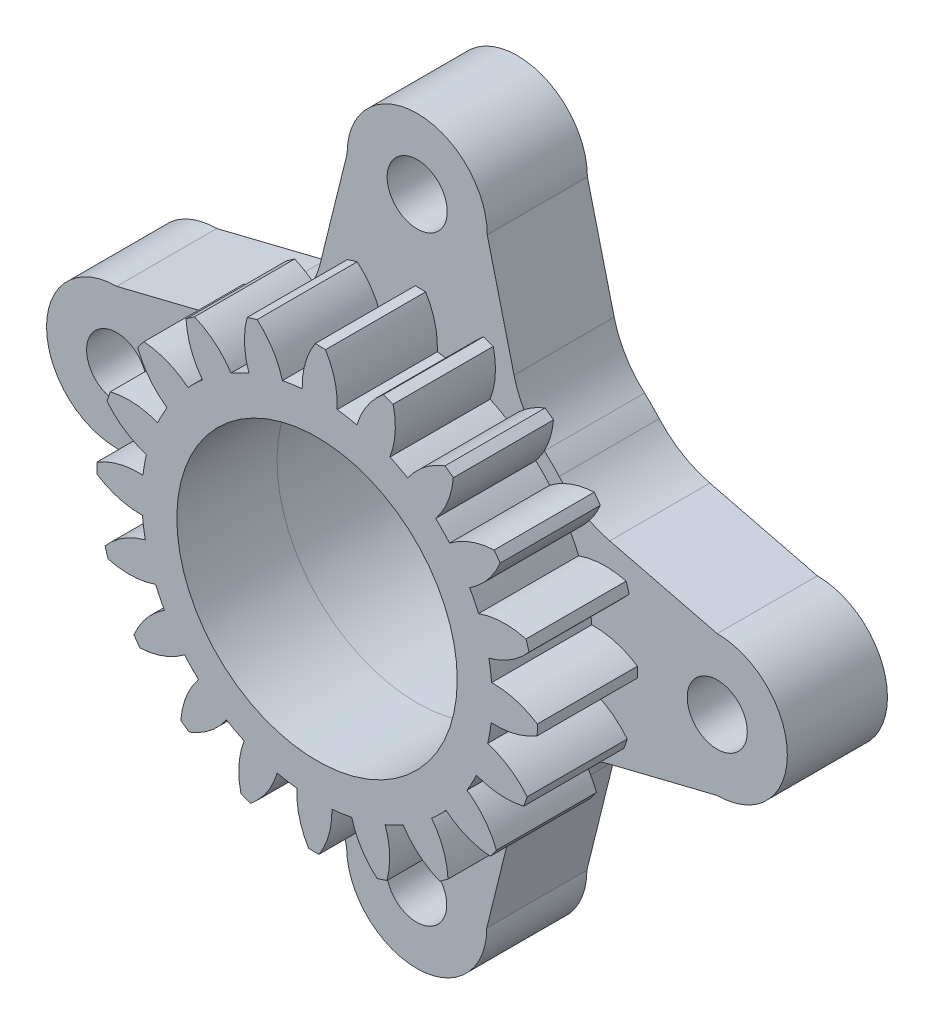
from build123d import *

# Parameters (mm, degrees)
SKETCH1_R           = 1.5
SKETCH1_R_2         = 7.000390829
BOSS_EXTRUDE1_DEPTH = 5
SKETCH2_R           = 7.000142015
BOSS_EXTRUDE2_DEPTH = 5


with BuildPart() as part:
    # Sketch1 → Boss-Extrude1 (new body)
    with BuildSketch(Plane.XY):
        with BuildLine():
            ThreePointArc((-6.338003131, 7.074694632), (-5.391106257, 8.221190043), (-4.823251658, 9.595455873))
            Line((-4.823251658, 9.595455873), (-3.487041473, 14.995112823))
            ThreePointArc((-3.487041473, 14.995112823), (0.012426609, 18.494580904), (3.51189469, 14.995112823))
            Line((3.51189469, 14.995112823), (4.848267417, 9.595629251))
            ThreePointArc((4.848267417, 9.595629251), (5.416171287, 8.221383781), (6.363109267, 7.07492232))
            ThreePointArc((6.363109267, 7.07492232), (6.742331178, 6.715466257), (7.101239088, 6.335725514))
            ThreePointArc((7.101239088, 6.335725514), (8.249501566, 5.385222774), (9.626938856, 4.815460815))
            Line((9.626938856, 4.815460815), (14.995112823, 3.487041473))
            ThreePointArc((14.995112823, 3.487041473), (18.494580904, -0.012426609), (14.995112823, -3.51189469))
            Line((14.995112823, -3.51189469), (9.608207017, -4.845154419))
            ThreePointArc((9.608207017, -4.845154419), (8.234972776, -5.412450744), (7.089075973, -6.358240319))
            ThreePointArc((7.089075973, -6.358240319), (6.724992069, -6.741727958), (6.340156549, -7.104386862))
            ThreePointArc((6.340156549, -7.104386862), (5.385279673, -8.254780603), (4.813204337, -9.636057338))
            Line((4.813204337, -9.636057338), (3.487041473, -14.995112823))
            ThreePointArc((3.487041473, -14.995112823), (-0.012426609, -18.494580904), (-3.51189469, -14.995112823))
            Line((-3.51189469, -14.995112823), (-4.852683271, -9.577787425))
            ThreePointArc((-4.852683271, -9.577787425), (-5.417036912, -8.209458802), (-6.357264888, -7.066309816))
            ThreePointArc((-6.357264888, -7.066309816), (-6.727300743, -6.714048101), (-7.07788588, -6.342423408))
            ThreePointArc((-7.07788588, -6.342423408), (-8.226525366, -5.391148916), (-9.604640685, -4.820978766))
            Line((-9.604640685, -4.820978766), (-14.995112823, -3.487041473))
            ThreePointArc((-14.995112823, -3.487041473), (-18.494580904, 0.012426609), (-14.995112823, 3.51189469))
            Line((-14.995112823, 3.51189469), (-9.565236804, 4.855789551))
            ThreePointArc((-9.565236804, 4.855789551), (-8.195892838, 5.42075163), (-7.052173955, 6.362129432))
            ThreePointArc((-7.052173955, 6.362129432), (-6.70454384, 6.727888635), (-6.338003131, 7.074694632))
        make_face()
        with Locations((-14.995112823, 0.012426609)):
            Circle(SKETCH1_R, mode=Mode.SUBTRACT)
        with Locations((-0.012426609, -14.995112823)):
            Circle(SKETCH1_R, mode=Mode.SUBTRACT)
        with Locations((14.995112823, -0.012426609)):
            Circle(SKETCH1_R, mode=Mode.SUBTRACT)
        with Locations((0.012426609, 14.995112823)):
            Circle(SKETCH1_R, mode=Mode.SUBTRACT)
        with Locations((0.012679975, -0.004471109)):
            Circle(SKETCH1_R_2, mode=Mode.SUBTRACT)
    extrude(amount=BOSS_EXTRUDE1_DEPTH)

    # Sketch2 → Boss-Extrude2 (add)
    with BuildSketch(Plane.XY.offset(5)):
        with BuildLine():
            ThreePointArc((-1.975646373, -8.524471748), (-1.485556757, -8.624173903), (-0.99057083, -8.695709093))
            ThreePointArc((-0.99057083, -8.695709093), (-0.87525992, -9.889949216), (-0.410977031, -10.996270813))
            ThreePointArc((-0.410977031, -10.996270813), (-0.152521624, -11.003195112), (0.106025131, -11.004043085))
            ThreePointArc((0.106025131, -11.004043085), (0.603354126, -9.912177733), (0.754511666, -8.721943523))
            ThreePointArc((0.754511666, -8.721943523), (1.251424249, -8.665319887), (1.744289429, -8.580394833))
            ThreePointArc((1.744289429, -8.580394833), (2.222997115, -9.680551652), (3.006428557, -10.589254713))
            ThreePointArc((3.006428557, -10.589254713), (3.254373982, -10.515973), (3.500528596, -10.43688413))
            ThreePointArc((3.500528596, -10.43688413), (3.636111629, -9.24477536), (3.412068393, -8.06608511))
            ThreePointArc((3.412068393, -8.06608511), (3.867162678, -7.8586784), (4.309662034, -7.625606156))
            ThreePointArc((4.309662034, -7.625606156), (5.104907252, -8.523988658), (6.130799518, -9.146122996))
            ThreePointArc((6.130799518, -9.146122996), (6.343964336, -8.999808595), (6.553631481, -8.848524651))
            ThreePointArc((6.553631481, -8.848524651), (6.314196738, -7.672864376), (5.736883641, -6.621096501))
            ThreePointArc((5.736883641, -6.621096501), (6.105611827, -6.283209129), (6.45443044, -5.924804432))
            ThreePointArc((6.45443044, -5.924804432), (7.488369047, -6.533472677), (8.656300655, -6.808139449))
            ThreePointArc((8.656300655, -6.808139449), (8.813818807, -6.603114633), (8.966474802, -6.394444341))
            ThreePointArc((8.966474802, -6.394444341), (8.375459825, -5.350314381), (7.501388295, -4.528423247))
            ThreePointArc((7.501388295, -4.528423247), (7.747656699, -4.093129985), (7.968649771, -3.644475983))
            ThreePointArc((7.968649771, -3.644475983), (9.140072652, -3.903849283), (10.335718319, -3.804162191))
            ThreePointArc((10.335718319, -3.804162191), (10.422170832, -3.560496218), (10.502872644, -3.31486568))
            ThreePointArc((10.502872644, -3.31486568), (9.618130097, -2.504472749), (8.532860344, -1.992910788))
            ThreePointArc((8.532860344, -1.992910788), (8.632562499, -1.502821172), (8.704097689, -1.007835246))
            ThreePointArc((8.704097689, -1.007835246), (9.898337812, -0.892524335), (11.004659408, -0.428241446))
            ThreePointArc((11.004659408, -0.428241446), (11.011583708, -0.169786039), (11.012431681, 0.088760716))
            ThreePointArc((11.012431681, 0.088760716), (9.920566329, 0.586089711), (8.730332119, 0.73724725))
            ThreePointArc((8.730332119, 0.73724725), (8.673708483, 1.234159833), (8.588783429, 1.727025014))
            ThreePointArc((8.588783429, 1.727025014), (9.688940248, 2.2057327), (10.597643309, 2.989164142))
            ThreePointArc((10.597643309, 2.989164142), (10.524361596, 3.237109567), (10.445272725, 3.483264181))
            ThreePointArc((10.445272725, 3.483264181), (9.253163956, 3.618847213), (8.074473706, 3.394803978))
            ThreePointArc((8.074473706, 3.394803978), (7.867066996, 3.849898262), (7.633994752, 4.292397619))
            ThreePointArc((7.633994752, 4.292397619), (8.532377254, 5.087642837), (9.154511592, 6.113535103))
            ThreePointArc((9.154511592, 6.113535103), (9.008197191, 6.326699921), (8.856913247, 6.536367065))
            ThreePointArc((8.856913247, 6.536367065), (7.681252972, 6.296932323), (6.629485097, 5.719619226))
            ThreePointArc((6.629485097, 5.719619226), (6.291597725, 6.088347412), (5.933193028, 6.437166024))
            ThreePointArc((5.933193028, 6.437166024), (6.541861273, 7.471104631), (6.816528045, 8.639036239))
            ThreePointArc((6.816528045, 8.639036239), (6.611503229, 8.796554392), (6.402832937, 8.949210386))
            ThreePointArc((6.402832937, 8.949210386), (5.358702977, 8.35819541), (4.536811843, 7.484123879))
            ThreePointArc((4.536811843, 7.484123879), (4.101518581, 7.730392283), (3.652864579, 7.951385355))
            ThreePointArc((3.652864579, 7.951385355), (3.912237879, 9.122808237), (3.812550787, 10.318453903))
            ThreePointArc((3.812550787, 10.318453903), (3.568884814, 10.404906417), (3.323254276, 10.485608228))
            ThreePointArc((3.323254276, 10.485608228), (2.512861345, 9.600865682), (2.001299384, 8.515595929))
            ThreePointArc((2.001299384, 8.515595929), (1.511209768, 8.615298084), (1.016223842, 8.686833274))
            ThreePointArc((1.016223842, 8.686833274), (0.900912931, 9.881073396), (0.436630042, 10.987394993))
            ThreePointArc((0.436630042, 10.987394993), (0.178174635, 10.994319293), (-0.08037212, 10.995167266))
            ThreePointArc((-0.08037212, 10.995167266), (-0.577701115, 9.903301914), (-0.728858654, 8.713067704))
            ThreePointArc((-0.728858654, 8.713067704), (-1.225771237, 8.656444068), (-1.718636418, 8.571519013))
            ThreePointArc((-1.718636418, 8.571519013), (-2.197344104, 9.671675833), (-2.980775546, 10.580378893))
            ThreePointArc((-2.980775546, 10.580378893), (-3.228720971, 10.507097181), (-3.474875585, 10.42800831))
            ThreePointArc((-3.474875585, 10.42800831), (-3.610458617, 9.235899541), (-3.386415382, 8.057209291))
            ThreePointArc((-3.386415382, 8.057209291), (-3.841509666, 7.84980258), (-4.284009023, 7.616730337))
            ThreePointArc((-4.284009023, 7.616730337), (-5.079254241, 8.515112839), (-6.105146507, 9.137247176))
            ThreePointArc((-6.105146507, 9.137247176), (-6.318311325, 8.990932776), (-6.527978469, 8.839648831))
            ThreePointArc((-6.527978469, 8.839648831), (-6.288543727, 7.663988557), (-5.71123063, 6.612220681))
            ThreePointArc((-5.71123063, 6.612220681), (-6.079958816, 6.27433331), (-6.428777428, 5.915928612))
            ThreePointArc((-6.428777428, 5.915928612), (-7.462716035, 6.524596858), (-8.630647643, 6.799263629))
            ThreePointArc((-8.630647643, 6.799263629), (-8.788165796, 6.594238814), (-8.94082179, 6.385568522))
            ThreePointArc((-8.94082179, 6.385568522), (-8.349806814, 5.341438561), (-7.475735283, 4.519547428))
            ThreePointArc((-7.475735283, 4.519547428), (-7.722003687, 4.084254165), (-7.942996759, 3.635600163))
            ThreePointArc((-7.942996759, 3.635600163), (-9.114419641, 3.894973464), (-10.310065307, 3.795286371))
            ThreePointArc((-10.310065307, 3.795286371), (-10.396517821, 3.551620399), (-10.477219632, 3.305989861))
            ThreePointArc((-10.477219632, 3.305989861), (-9.592477086, 2.49559693), (-8.507207333, 1.984034969))
            ThreePointArc((-8.507207333, 1.984034969), (-8.606909488, 1.493945353), (-8.678444678, 0.998959426))
            ThreePointArc((-8.678444678, 0.998959426), (-9.8726848, 0.883648516), (-10.979006397, 0.419365627))
            ThreePointArc((-10.979006397, 0.419365627), (-10.985930697, 0.16091022), (-10.98677867, -0.097636535))
            ThreePointArc((-10.98677867, -0.097636535), (-9.894913318, -0.59496553), (-8.704679108, -0.74612307))
            ThreePointArc((-8.704679108, -0.74612307), (-8.648055472, -1.243035653), (-8.563130417, -1.735900833))
            ThreePointArc((-8.563130417, -1.735900833), (-9.663287237, -2.21460852), (-10.571990298, -2.998039961))
            ThreePointArc((-10.571990298, -2.998039961), (-10.498708585, -3.245985386), (-10.419619714, -3.49214))
            ThreePointArc((-10.419619714, -3.49214), (-9.227510945, -3.627723033), (-8.048820695, -3.403679798))
            ThreePointArc((-8.048820695, -3.403679798), (-7.841413984, -3.858774082), (-7.608341741, -4.301273438))
            ThreePointArc((-7.608341741, -4.301273438), (-8.506724243, -5.096518656), (-9.128858581, -6.122410922))
            ThreePointArc((-9.128858581, -6.122410922), (-8.98254418, -6.33557574), (-8.831260235, -6.545242885))
            ThreePointArc((-8.831260235, -6.545242885), (-7.655599961, -6.305808142), (-6.603832085, -5.728495045))
            ThreePointArc((-6.603832085, -5.728495045), (-6.265944714, -6.097223231), (-5.907540017, -6.446041844))
            ThreePointArc((-5.907540017, -6.446041844), (-6.516208262, -7.479980451), (-6.790875033, -8.647912059))
            ThreePointArc((-6.790875033, -8.647912059), (-6.585850218, -8.805430212), (-6.377179926, -8.958086206))
            ThreePointArc((-6.377179926, -8.958086206), (-5.333049965, -8.367071229), (-4.511158832, -7.492999699))
            ThreePointArc((-4.511158832, -7.492999699), (-4.075865569, -7.739268103), (-3.627211567, -7.960261175))
            ThreePointArc((-3.627211567, -7.960261175), (-3.886584868, -9.131684056), (-3.786897776, -10.327329723))
            ThreePointArc((-3.786897776, -10.327329723), (-3.543231803, -10.413782236), (-3.297601265, -10.494484048))
            ThreePointArc((-3.297601265, -10.494484048), (-2.487208334, -9.609741501), (-1.975646373, -8.524471748))
        make_face()
        with Locations(Location((0.012426609, -0.004693816, 0), (0, 0, 178.840939511))):
            Circle(SKETCH2_R, mode=Mode.SUBTRACT)
    extrude(amount=BOSS_EXTRUDE2_DEPTH)


solid = part.part
